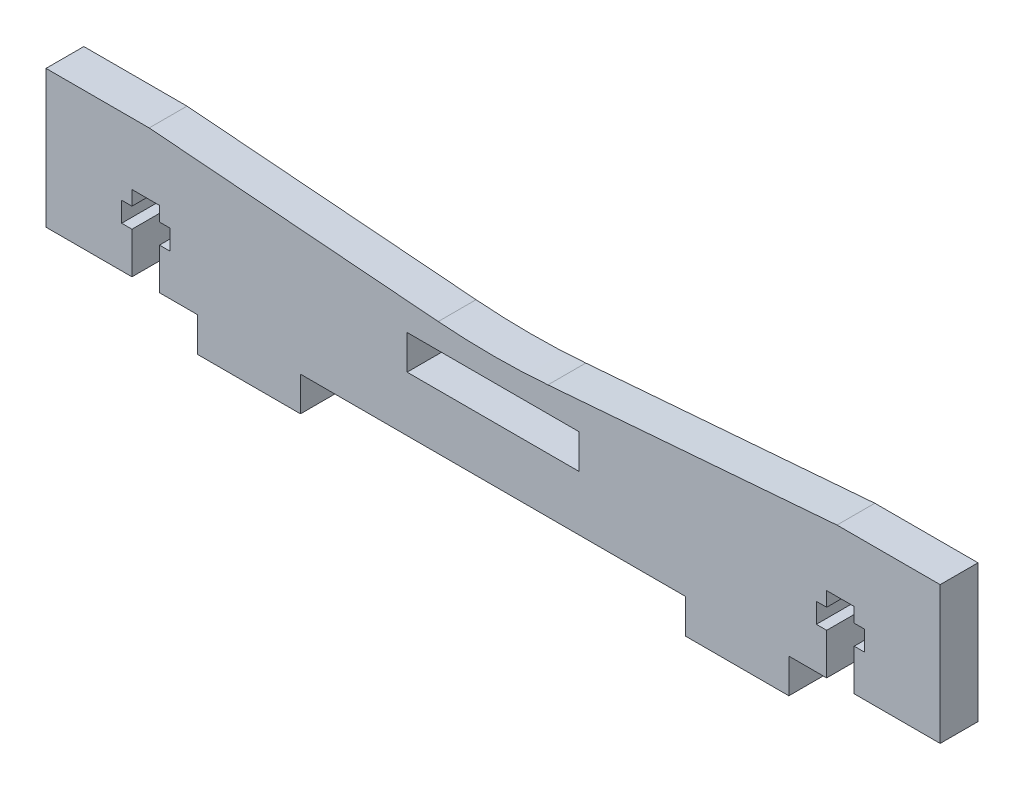
from build123d import *

# Parameters (mm, degrees)
SKETCH_1_W      = 25
SKETCH_1_H      = 5
EXTRUDE_1_DEPTH = 5.5
FILLET_1_R      = 100


with BuildPart() as part:
    # 草图1 → 凸台-拉伸1 (new body)
    with BuildSketch(Plane.XY):
        Polygon((-15, 20), (-65, 16), (-115, 20), (-130, 20), (-130, 0), (-117.5, 0), (-117.5, 6), (-119, 6), (-119, 8.9), (-117.5, 8.9), (-117.5, 11), (-113.5, 11), (-113.5, 8.9), (-112, 8.9), (-112, 6), (-113.5, 6), (-113.5, 0), (-108, 0), (-108, -5), (-93, -5), (-93, 0), (-37, 0), (-37, -5), (-22, -5), (-22, 0), (-16.5, 0), (-16.5, 6), (-18, 6), (-18, 8.9), (-16.5, 8.9), (-16.5, 11), (-12.5, 11), (-12.5, 8.9), (-11, 8.9), (-11, 6), (-12.5, 6), (-12.5, 0), (0, 0), (0, 20), align=None)
        with Locations((-65, 10.5)):
            Rectangle(SKETCH_1_W, SKETCH_1_H, mode=Mode.SUBTRACT)
    extrude(amount=EXTRUDE_1_DEPTH)

    # 圆角1
    fillet_1_edges = [part.edges().sort_by_distance(p)[0] for p in [
        (-65, 16, 2.75),
    ]]
    fillet(fillet_1_edges, radius=FILLET_1_R)


solid = part.part
